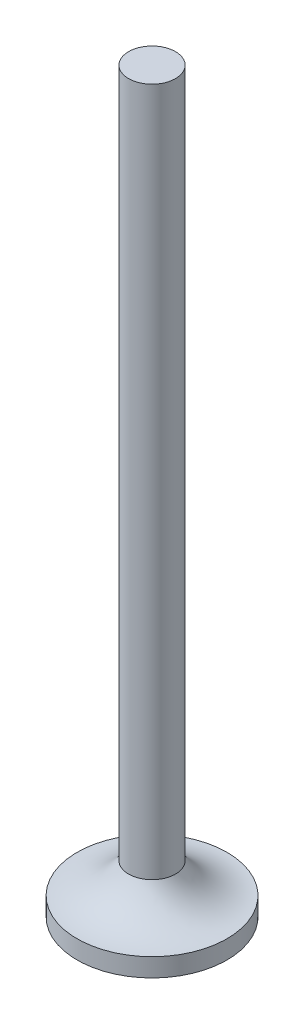
from build123d import *


with BuildPart() as part:
    # Sketch1 → Revolve1 (revolve)
    with BuildSketch(Plane.XY, mode=Mode.PRIVATE) as revolve1_sk:
        with BuildLine():
            Line((0, 0), (10.16, 0))
            Line((10.16, 0), (10.16, 2.5))
            ThreePointArc((10.16, 2.5), (6.110294408, 3.600733038), (3.175, 6.600028846))
            Line((3.175, 6.600028846), (3.175, 100))
            Line((3.175, 100), (0, 100))
            Line((0, 100), (0, 0))
        make_face()
    revolve(revolve1_sk.sketch.rotate(Axis((0, -31.831703756, 0), (0, 1, 0)), 90), axis=Axis((0, -31.831703756, 0), (0, 1, 0)))


solid = part.part
